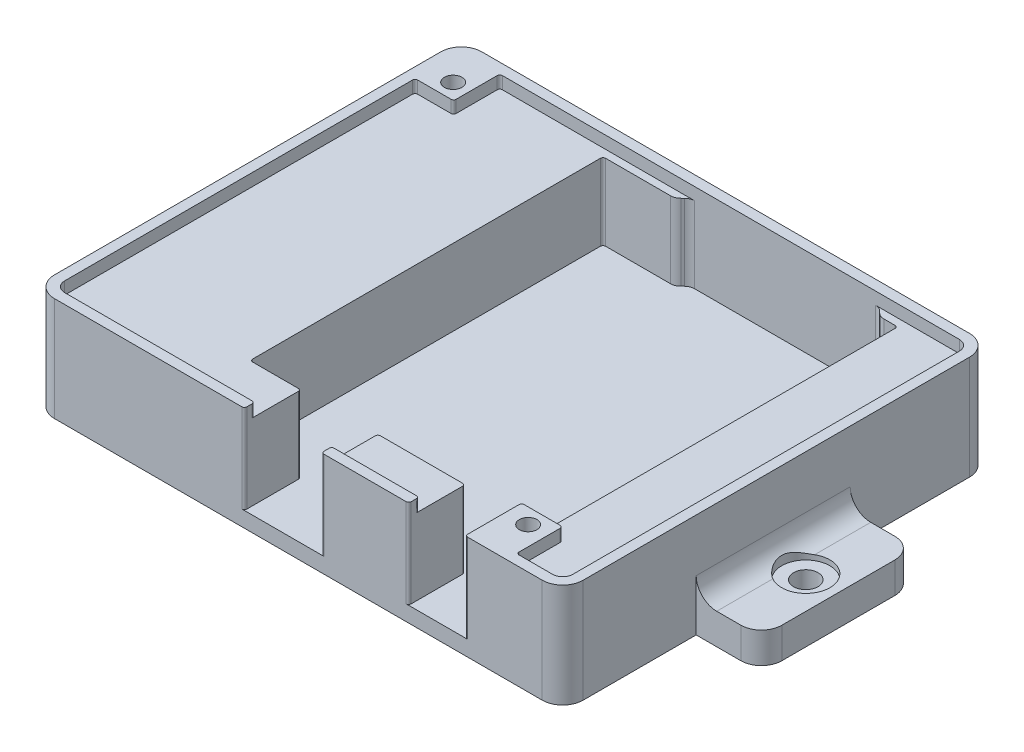
from build123d import *

# Parameters (mm, degrees)
SKETCH1_W           = 103
SKETCH1_H           = 83.25
BOSS_EXTRUDE1_DEPTH = 20.2438
CUT_EXTRUDE1_DEPTH  = 17.2438
SKETCH3_W           = 15
SKETCH3_H           = 17.2438
SKETCH3_W_2         = 11
CUT_EXTRUDE2_DEPTH  = 14.9225
CUT_EXTRUDE3_DEPTH  = 2.4
SKETCH5_W           = 30
SKETCH5_H           = 6
BOSS_EXTRUDE2_DEPTH = 12.7
SKETCH6_W           = 30
SKETCH6_H           = 6
BOSS_EXTRUDE3_DEPTH = 12.7
FILLET1_R           = 4
FILLET2_R           = 0.5
FILLET3_R           = 2
FILLET4_R           = 4
FILLET5_R           = 2
SKETCH7_R           = 1.7145
CUT_EXTRUDE4_DEPTH  = 152.66642324
SKETCH8_R           = 3.81
CUT_EXTRUDE5_DEPTH  = 3.302
SKETCH11_R          = 2.38125
CUT_EXTRUDE7_DEPTH  = 151.98270874
CUT_EXTRUDE8_START  = -1
SKETCH12_R          = 4.699
CUT_EXTRUDE8_DEPTH  = 152.98270874


with BuildPart() as part:
    # Sketch1 → Boss-Extrude1 (new body)
    with BuildSketch(Plane(origin=(0, 0, 0), x_dir=(1, 0, 0), z_dir=(0, 1, 0))):
        with Locations((51.5, 41.625)):
            Rectangle(SKETCH1_W, SKETCH1_H)
    extrude(amount=BOSS_EXTRUDE1_DEPTH)

    # Sketch2 → Cut-Extrude1 (cut)
    with BuildSketch(Plane(origin=(0, 20.2438, 0), x_dir=(1, 0, 0), z_dir=(0, 1, 0))):
        Polygon((31.1, 79.75), (45.1, 79.75), (46.6, 81.25), (83.5, 81.25), (85, 79.75), (88.5, 79.75), (88.5, 11), (31.1, 11), align=None)
    extrude(amount=-CUT_EXTRUDE1_DEPTH, mode=Mode.SUBTRACT)

    # Sketch3 → Cut-Extrude2 (cut)
    with BuildSketch(Plane.XY):
        with Locations((48.5, 11.6219)):
            Rectangle(SKETCH3_W, SKETCH3_H)
        with Locations((78.5, 11.6219)):
            Rectangle(SKETCH3_W_2, SKETCH3_H)
    extrude(amount=-CUT_EXTRUDE2_DEPTH, mode=Mode.SUBTRACT)

    # Sketch4 → Cut-Extrude3 (cut)
    with BuildSketch(Plane(origin=(0, 20.2438, 0), x_dir=(1, 0, 0), z_dir=(0, 1, 0))):
        Polygon((9.5, 81.25), (101, 81.25), (101, 2), (92, 2), (92, 11), (84, 11), (84, 2), (2, 2), (2, 72.25), (9.5, 72.25), align=None)
    extrude(amount=-CUT_EXTRUDE3_DEPTH, mode=Mode.SUBTRACT)

    # Sketch5 → Boss-Extrude2 (add)
    with BuildSketch(Plane.ZY):
        with Locations((-41, 3)):
            Rectangle(SKETCH5_W, SKETCH5_H)
    boss_extrude2 = extrude(amount=BOSS_EXTRUDE2_DEPTH)

    # Mirror1: Boss-Extrude2 across plane
    add(boss_extrude2.mirror(Plane.ZY.offset(-51.5)))

    # Sketch6 → Boss-Extrude3 (add)
    with BuildSketch(Plane(origin=(0, 0, -83.25), x_dir=(-1, 0, 0), z_dir=(0, 0, -1))):
        with Locations((-51.5, 3)):
            Rectangle(SKETCH6_W, SKETCH6_H)
    extrude(amount=BOSS_EXTRUDE3_DEPTH)

    # Fillet1
    fillet1_edges = [part.edges().sort_by_distance(p)[0] for p in [
        (0, 10.1219, -83.25),
        (103, 10.1219, -83.25),
        (103, 10.1219, 0),
        (0, 10.1219, 0),
    ]]
    fillet(fillet1_edges, radius=FILLET1_R)

    # Fillet2
    fillet2_edges = [part.edges().sort_by_distance(p)[0] for p in [
        (9.5, 19.0438, -81.25),
        (92, 19.0438, -11),
        (73, 19.0438, -2),
        (41, 19.0438, -2),
        (92, 19.0438, -2),
        (2, 19.0438, -72.25),
        (9.5, 19.0438, -72.25),
        (88.5, 10.4219, -11),
        (88.5, 10.4219, -79.75),
        (31.1, 10.4219, -79.75),
        (31.1, 10.4219, -11),
        (84, 11.6219, -11),
        (56, 10.4219, -11),
        (41, 11.6219, 0),
        (56, 11.6219, 0),
        (73, 11.6219, 0),
        (84, 11.6219, 0),
        (56, 19.0438, -2),
        (41, 10.4219, -11),
        (73, 10.4219, -11),
    ]]
    fillet(fillet2_edges, radius=FILLET2_R)

    # Fillet3
    fillet3_edges = [part.edges().sort_by_distance(p)[0] for p in [
        (101, 19.0438, -2),
        (2, 19.0438, -2),
        (101, 19.0438, -81.25),
    ]]
    fillet(fillet3_edges, radius=FILLET3_R)

    # Fillet4
    fillet4_edges = [part.edges().sort_by_distance(p)[0] for p in [
        (0, 6, -41),
        (-12.7, 3, -56),
        (-12.7, 3, -26),
        (115.7, 3, -56),
        (115.7, 3, -26),
        (103, 6, -41),
        (51.5, 6, -83.25),
        (66.5, 3, -95.95),
        (36.5, 3, -95.95),
    ]]
    fillet(fillet4_edges, radius=FILLET4_R)

    # Fillet5
    fillet5_edges = [part.edges().sort_by_distance(p)[0] for p in [
        (85, 10.4219, -79.75),
        (83.5, 10.4219, -81.25),
        (46.6, 10.4219, -81.25),
        (45.1, 10.4219, -79.75),
    ]]
    fillet(fillet5_edges, radius=FILLET5_R)

    # Sketch7 → Cut-Extrude4 (cut, through all)
    with BuildSketch(Plane(origin=(0, 20.2438, 0), x_dir=(1, 0, 0), z_dir=(0, 1, 0))):
        with Locations(Location((6.35, 75.3125, 0), (0, 0, 270))):
            Circle(SKETCH7_R)
        with Locations(Location((88.265, 8.0025, 0), (0, 0, 270))):
            Circle(SKETCH7_R)
    extrude(amount=-CUT_EXTRUDE4_DEPTH, mode=Mode.SUBTRACT)

    # Sketch8 → Cut-Extrude5 (cut)
    with BuildSketch(Plane.XZ):
        with Locations(Location((6.35, -75.3125, 0), (0, 0, 270))):
            Circle(SKETCH8_R)
        with Locations(Location((88.265, -8.0025, 0), (0, 0, 270))):
            Circle(SKETCH8_R)
    extrude(amount=-CUT_EXTRUDE5_DEPTH, mode=Mode.SUBTRACT)

    # Sketch11 → Cut-Extrude7 (cut, through all)
    with BuildSketch(Plane(origin=(0, 6, 0), x_dir=(1, 0, 0), z_dir=(0, 1, 0))):
        with Locations(Location((-6.35, 41, 0), (0, 0, 270))):
            Circle(SKETCH11_R)
    cut_extrude7 = extrude(amount=-CUT_EXTRUDE7_DEPTH, mode=Mode.SUBTRACT)

    # Sketch12 → Cut-Extrude8 (cut)
    with BuildSketch(Plane(origin=(0, 6, 0), x_dir=(1, 0, 0), z_dir=(0, 1, 0)).offset(CUT_EXTRUDE8_START)):
        with Locations(Location((-6.35, 41, 0), (0, 0, 59.992960011))):
            Circle(SKETCH12_R)
    cut_extrude8 = extrude(amount=CUT_EXTRUDE8_DEPTH, mode=Mode.SUBTRACT)

    # Sketch-Pattern2: Cut-Extrude7, Cut-Extrude8 at 2 more places
    with Locations((57.85, 0, -48.6), (115.7, 0, 0)):
        add(cut_extrude7, mode=Mode.SUBTRACT)
        add(cut_extrude8, mode=Mode.SUBTRACT)


solid = part.part
